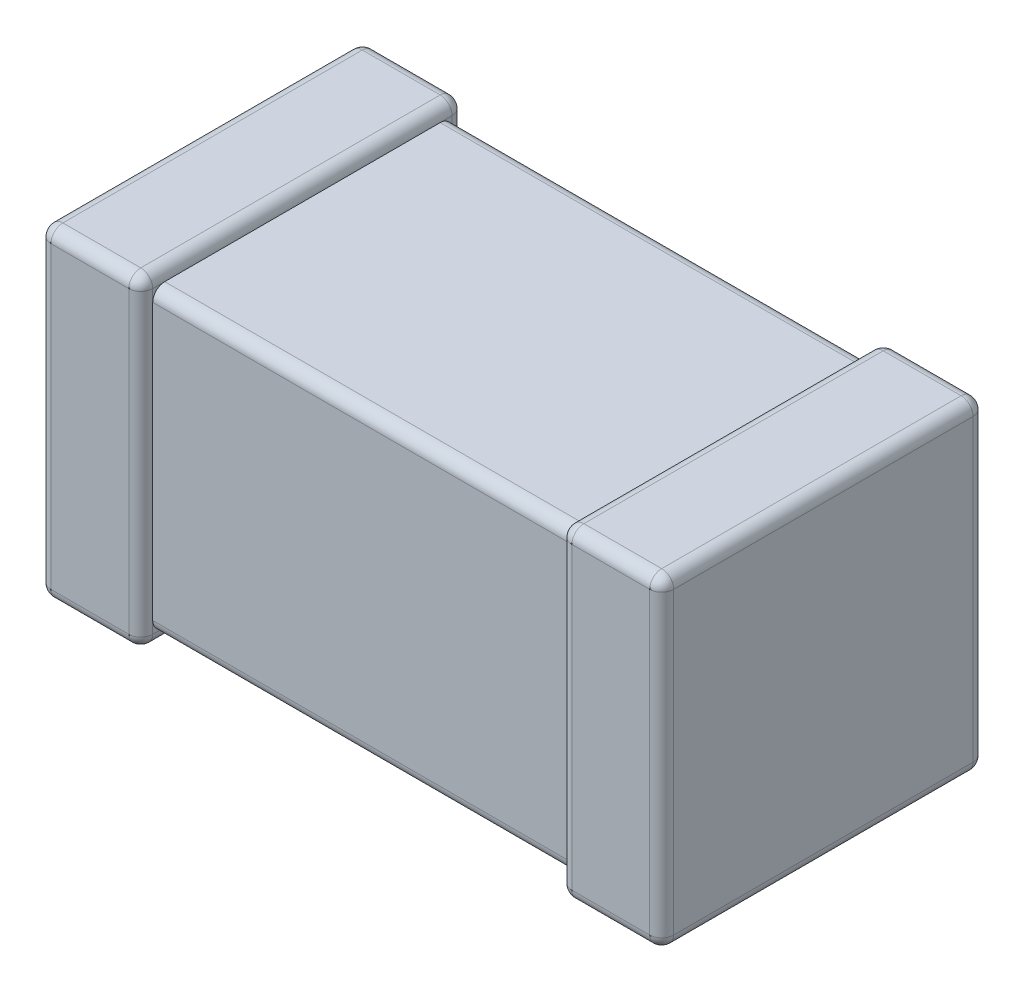
from build123d import *

# Parameters (mm, degrees)
SKETCH2_W                = 1
SKETCH2_H                = 0.5
BOSS_EXTRUDE1_DEPTH      = 0.5
FILLET3_R                = 0.02
BOSS_EXTRUDE3_DEPTH      = 0.02
BOSS_EXTRUDE3_DEPTH_BACK = 0.52
SKETCH3_W                = 0.17
SKETCH3_H                = 0.54
FILLET4_R                = 0.02
BOSS_EXTRUDE4_DEPTH      = 0.01
BOSS_EXTRUDE4_2_DEPTH    = 0.01
BOSS_EXTRUDE4_3_DEPTH    = 0.01


with BuildPart() as part:
    # Sketch2 → Boss-Extrude1 (new body)
    with BuildSketch(Plane(origin=(0, 0, 0), x_dir=(1, 0, 0), z_dir=(0, 1, 0))):
        with Locations((0.5, 0.25)):
            Rectangle(SKETCH2_W, SKETCH2_H)
    extrude(amount=BOSS_EXTRUDE1_DEPTH)

    # Fillet3
    fillet3_edges = [part.edges().sort_by_distance(p)[0] for p in [
        (0, 0, -0.25),
        (0.5, 0, -0.5),
        (1, 0, -0.25),
        (0.5, 0, 0),
        (0, 0.5, -0.25),
        (0.5, 0.5, -0.5),
        (1, 0.5, -0.25),
        (0.5, 0.5, 0),
        (0, 0.25, -0.5),
        (1, 0.25, -0.5),
        (1, 0.25, 0),
        (0, 0.25, 0),
    ]]
    fillet(fillet3_edges, radius=FILLET3_R)


with BuildPart() as body_2:
    # Sketch3 → Boss-Extrude3 (new, two sides: drawn at the far end of the back side and taken through both)
    with BuildSketch(Plane.XY.offset(-BOSS_EXTRUDE3_DEPTH_BACK)):
        with Locations((0.065, 0.25)):
            Rectangle(SKETCH3_W, SKETCH3_H)
    extrude(amount=BOSS_EXTRUDE3_DEPTH + BOSS_EXTRUDE3_DEPTH_BACK)

    # Fillet4
    fillet4_edges = [body_2.edges().sort_by_distance(p)[0] for p in [
        (-0.02, 0.52, -0.25),
        (0.15, 0.52, -0.25),
        (-0.02, -0.02, -0.25),
        (0.15, -0.02, -0.25),
        (0.065, -0.02, -0.52),
        (0.15, 0.25, -0.52),
        (0.065, 0.52, -0.52),
        (-0.02, 0.25, -0.52),
        (0.065, 0.52, 0.02),
        (0.15, 0.25, 0.02),
        (0.065, -0.02, 0.02),
        (-0.02, 0.25, 0.02),
    ]]
    fillet(fillet4_edges, radius=FILLET4_R)


with BuildPart() as body_3:
    # Body-Move/Copy1: copy of body 2
    add(body_2.part.moved(Location((0.87, 0, 0))))


with BuildPart() as body_4:
    # Sketch4 → Boss-Extrude4 (new body)
    with BuildSketch(Plane.XY):
        with BuildLine():
            Line((0.399439087, 0.336565272), (0.424243775, 0.311425763))
            Line((0.424243775, 0.311425763), (0.424662301, 0.309556343))
            Line((0.424662301, 0.309556343), (0.424662301, 0.284640048))
            Line((0.424662301, 0.284640048), (0.424243775, 0.283189155))
            Line((0.424243775, 0.283189155), (0.39885315, 0.258049647))
            Line((0.39885315, 0.258049647), (0.397011632, 0.257435807))
            Line((0.397011632, 0.257435807), (0.351336409, 0.257435807))
            Line((0.351336409, 0.257435807), (0.330019444, 0.236927995))
            Line((0.330019444, 0.236927995), (0.330019444, 0.196721522))
            Line((0.330019444, 0.196721522), (0.421397792, 0.196721522))
            add(Edge.make_bspline(
                [(0.421397792, 0.196721522), (0.421888097, 0.196611548), (0.422821182, 0.196402261), (0.423981763, 0.195437698), (0.424583336, 0.193958707), (0.424634441, 0.192857555), (0.424662301, 0.192257236)],
                knots=[0, 0, 0, 0, 0.972653314, 1.851030225, 2.828438158, 4, 4, 4, 4], degree=3))
            add(Edge.make_bspline(
                [(0.424662301, 0.192257236), (0.424632899, 0.191665735), (0.424577121, 0.190543651), (0.424034695, 0.189237989), (0.423301483, 0.188424544), (0.422456151, 0.188038901), (0.421379922, 0.187838563), (0.420580409, 0.187809099), (0.420142212, 0.18779295)],
                knots=[0, 0, 0, 0, 1.434830483, 2.721889557, 3.346325591, 4.054937858, 4.933952885, 6, 6, 6, 6], degree=3))
            Line((0.420142212, 0.18779295), (0.323769444, 0.18779295))
            add(Edge.make_bspline(
                [(0.323769444, 0.18779295), (0.323445712, 0.187938021), (0.322830678, 0.188213629), (0.322049992, 0.188823322), (0.321440854, 0.189552425), (0.321207164, 0.190128865), (0.321090873, 0.190415718)],
                knots=[0, 0, 0, 0, 1.095907464, 2.08203456, 3.045567458, 4, 4, 4, 4], degree=3))
            Line((0.321090873, 0.190415718), (0.321090873, 0.194461477))
            Line((0.321090873, 0.194461477), (0.321090873, 0.241308575))
            Line((0.321090873, 0.241308575), (0.346537301, 0.265973754))
            Line((0.346537301, 0.265973754), (0.347792882, 0.266364379))
            Line((0.347792882, 0.266364379), (0.394388864, 0.266364379))
            Line((0.394388864, 0.266364379), (0.41573373, 0.287597638))
            Line((0.41573373, 0.287597638), (0.41573373, 0.30763112))
            Line((0.41573373, 0.30763112), (0.394667882, 0.328864379))
            Line((0.394667882, 0.328864379), (0.350722569, 0.328864379))
            Line((0.350722569, 0.328864379), (0.327424578, 0.305426879))
            add(Edge.make_bspline(
                [(0.327424578, 0.305426879), (0.32705561, 0.305309061), (0.32639099, 0.305096838), (0.325696629, 0.305035595), (0.325387748, 0.305008352)],
                knots=[0, 0, 0, 0, 1.110314269, 2, 2, 2, 2], degree=3))
            add(Edge.make_bspline(
                [(0.325387748, 0.305008352), (0.324817831, 0.305056183), (0.32369671, 0.305150274), (0.322468399, 0.305923024), (0.321754387, 0.306787209), (0.321349387, 0.307594449), (0.321143104, 0.308551116), (0.321108783, 0.309229987), (0.321090873, 0.309584245)],
                knots=[0, 0, 0, 0, 1.43776488, 2.828318719, 3.533469534, 4.273415568, 5.099010321, 6, 6, 6, 6], degree=3))
            Line((0.321090873, 0.309584245), (0.3215094, 0.311453664))
            Line((0.3215094, 0.311453664), (0.346732614, 0.336955897))
            Line((0.346732614, 0.336955897), (0.348378819, 0.33779295))
            Line((0.348378819, 0.33779295), (0.397988194, 0.337597638))
            Line((0.397988194, 0.337597638), (0.399439087, 0.336565272))
        make_face()
    extrude(amount=BOSS_EXTRUDE4_DEPTH)


with BuildPart() as body_5:
    # Sketch4 → Boss-Extrude4 2 (new body)
    with BuildSketch(Plane.XY):
        with BuildLine():
            Line((0.526403373, 0.336565272), (0.55120806, 0.311732682))
            Line((0.55120806, 0.311732682), (0.551626587, 0.309919066))
            Line((0.551626587, 0.309919066), (0.551626587, 0.285281789))
            Line((0.551626587, 0.285281789), (0.550984846, 0.283858798))
            Line((0.550984846, 0.283858798), (0.529109846, 0.262681343))
            Line((0.529109846, 0.262681343), (0.550984846, 0.241113263))
            Line((0.550984846, 0.241113263), (0.551626587, 0.239690272))
            Line((0.551626587, 0.239690272), (0.551626587, 0.214467057))
            Line((0.551626587, 0.214467057), (0.551012748, 0.212820852))
            Line((0.551012748, 0.212820852), (0.52573373, 0.187988263))
            Line((0.52573373, 0.187988263), (0.523668998, 0.18779295))
            Line((0.523668998, 0.18779295), (0.474561855, 0.18779295))
            Line((0.474561855, 0.18779295), (0.473334176, 0.188602102))
            Line((0.473334176, 0.188602102), (0.448250471, 0.21309987))
            add(Edge.make_bspline(
                [(0.448250471, 0.21309987), (0.448197162, 0.213359524), (0.448063174, 0.214012147), (0.448058171, 0.214679224), (0.448055159, 0.215080897)],
                knots=[0, 0, 0, 0, 0.795724138, 2, 2, 2, 2], degree=3))
            add(Edge.make_bspline(
                [(0.448055159, 0.215080897), (0.448056936, 0.215371945), (0.448059839, 0.215847069), (0.448197239, 0.216300367), (0.448250471, 0.216475986)],
                knots=[0, 0, 0, 0, 1.225148227, 2, 2, 2, 2], degree=3))
            add(Edge.make_bspline(
                [(0.448250471, 0.216475986), (0.448442469, 0.21685484), (0.448814478, 0.217588893), (0.449745762, 0.218420181), (0.45085685, 0.219041151), (0.451711199, 0.219189043), (0.452156721, 0.219266164)],
                knots=[0, 0, 0, 0, 1.004527468, 1.946335261, 2.929065655, 4, 4, 4, 4], degree=3))
            add(Edge.make_bspline(
                [(0.452156721, 0.219266164), (0.452485124, 0.219255055), (0.45313872, 0.219232945), (0.454055865, 0.218904713), (0.454915337, 0.218419753), (0.455375872, 0.217949444), (0.455616542, 0.217703664)],
                knots=[0, 0, 0, 0, 1.001337907, 1.992890517, 2.951104048, 4, 4, 4, 4], degree=3))
            Line((0.455616542, 0.217703664), (0.477686855, 0.196721522))
            Line((0.477686855, 0.196721522), (0.521632167, 0.196721522))
            Line((0.521632167, 0.196721522), (0.542698016, 0.217424647))
            Line((0.542698016, 0.217424647), (0.542698016, 0.236732682))
            Line((0.542698016, 0.236732682), (0.52135315, 0.257435807))
            Line((0.52135315, 0.257435807), (0.49838998, 0.257435807))
            add(Edge.make_bspline(
                [(0.49838998, 0.257435807), (0.497884806, 0.257633597), (0.496933871, 0.258005915), (0.495858152, 0.259110726), (0.495172431, 0.260509076), (0.495123421, 0.261565878), (0.495097569, 0.262123307)],
                knots=[0, 0, 0, 0, 1.043123538, 1.963565367, 2.925846864, 4, 4, 4, 4], degree=3))
            add(Edge.make_bspline(
                [(0.495097569, 0.262123307), (0.495164119, 0.262750362), (0.495299445, 0.264025455), (0.496109081, 0.265021239), (0.49652056, 0.265527325)],
                knots=[0, 0, 0, 0, 0.98354347, 2, 2, 2, 2], degree=3))
            add(Edge.make_bspline(
                [(0.49652056, 0.265527325), (0.496721079, 0.265655922), (0.497154904, 0.265934144), (0.497951618, 0.266210209), (0.498925746, 0.266329093), (0.499626731, 0.266351942), (0.500008284, 0.266364379)],
                knots=[0, 0, 0, 0, 0.78205906, 1.691991385, 2.743730218, 4, 4, 4, 4], degree=3))
            Line((0.500008284, 0.266364379), (0.52135315, 0.266364379))
            Line((0.52135315, 0.266364379), (0.542698016, 0.287597638))
            Line((0.542698016, 0.287597638), (0.542698016, 0.30763112))
            Line((0.542698016, 0.30763112), (0.521632167, 0.328864379))
            Line((0.521632167, 0.328864379), (0.477686855, 0.328864379))
            Line((0.477686855, 0.328864379), (0.454388864, 0.305426879))
            add(Edge.make_bspline(
                [(0.454388864, 0.305426879), (0.454019895, 0.305309061), (0.453355276, 0.305096838), (0.452660915, 0.305035595), (0.452352034, 0.305008352)],
                knots=[0, 0, 0, 0, 1.110314269, 2, 2, 2, 2], degree=3))
            add(Edge.make_bspline(
                [(0.452352034, 0.305008352), (0.451782116, 0.305056183), (0.450660996, 0.305150274), (0.449432685, 0.305923024), (0.448718672, 0.306787209), (0.448313673, 0.307594449), (0.44810739, 0.308551116), (0.448073069, 0.309229987), (0.448055159, 0.309584245)],
                knots=[0, 0, 0, 0, 1.43776488, 2.828318719, 3.533469534, 4.273415568, 5.099010321, 6, 6, 6, 6], degree=3))
            Line((0.448055159, 0.309584245), (0.448473685, 0.311453664))
            Line((0.448473685, 0.311453664), (0.4736969, 0.336955897))
            Line((0.4736969, 0.336955897), (0.475343105, 0.33779295))
            Line((0.475343105, 0.33779295), (0.52495248, 0.337597638))
            Line((0.52495248, 0.337597638), (0.526403373, 0.336565272))
        make_face()
    extrude(amount=BOSS_EXTRUDE4_2_DEPTH)


with BuildPart() as body_6:
    # Sketch4 → Boss-Extrude4 3 (new body)
    with BuildSketch(Plane.XY):
        with BuildLine():
            Line((0.653367659, 0.336565272), (0.678172346, 0.311732682))
            Line((0.678172346, 0.311732682), (0.678590873, 0.309919066))
            Line((0.678590873, 0.309919066), (0.678590873, 0.285281789))
            Line((0.678590873, 0.285281789), (0.677949132, 0.283858798))
            Line((0.677949132, 0.283858798), (0.656074132, 0.262681343))
            Line((0.656074132, 0.262681343), (0.677949132, 0.241113263))
            Line((0.677949132, 0.241113263), (0.678590873, 0.239690272))
            Line((0.678590873, 0.239690272), (0.678590873, 0.214467057))
            Line((0.678590873, 0.214467057), (0.677977034, 0.212820852))
            Line((0.677977034, 0.212820852), (0.652698016, 0.187988263))
            Line((0.652698016, 0.187988263), (0.650633284, 0.18779295))
            Line((0.650633284, 0.18779295), (0.601526141, 0.18779295))
            Line((0.601526141, 0.18779295), (0.600298462, 0.188602102))
            Line((0.600298462, 0.188602102), (0.575214757, 0.21309987))
            add(Edge.make_bspline(
                [(0.575214757, 0.21309987), (0.575161448, 0.213359524), (0.57502746, 0.214012147), (0.575022457, 0.214679224), (0.575019444, 0.215080897)],
                knots=[0, 0, 0, 0, 0.795724138, 2, 2, 2, 2], degree=3))
            add(Edge.make_bspline(
                [(0.575019444, 0.215080897), (0.575021222, 0.215371945), (0.575024125, 0.215847069), (0.575161524, 0.216300367), (0.575214757, 0.216475986)],
                knots=[0, 0, 0, 0, 1.225148227, 2, 2, 2, 2], degree=3))
            add(Edge.make_bspline(
                [(0.575214757, 0.216475986), (0.575406755, 0.21685484), (0.575778764, 0.217588893), (0.576710048, 0.218420181), (0.577821136, 0.219041151), (0.578675485, 0.219189043), (0.579121007, 0.219266164)],
                knots=[0, 0, 0, 0, 1.004527468, 1.946335261, 2.929065655, 4, 4, 4, 4], degree=3))
            add(Edge.make_bspline(
                [(0.579121007, 0.219266164), (0.579449409, 0.219255055), (0.580103006, 0.219232945), (0.581020151, 0.218904713), (0.581879623, 0.218419753), (0.582340157, 0.217949444), (0.582580828, 0.217703664)],
                knots=[0, 0, 0, 0, 1.001337907, 1.992890517, 2.951104048, 4, 4, 4, 4], degree=3))
            Line((0.582580828, 0.217703664), (0.604651141, 0.196721522))
            Line((0.604651141, 0.196721522), (0.648596453, 0.196721522))
            Line((0.648596453, 0.196721522), (0.669662301, 0.217424647))
            Line((0.669662301, 0.217424647), (0.669662301, 0.236732682))
            Line((0.669662301, 0.236732682), (0.648317435, 0.257435807))
            Line((0.648317435, 0.257435807), (0.625354266, 0.257435807))
            add(Edge.make_bspline(
                [(0.625354266, 0.257435807), (0.624849091, 0.257633597), (0.623898156, 0.258005915), (0.622822438, 0.259110726), (0.622136717, 0.260509076), (0.622087706, 0.261565878), (0.622061855, 0.262123307)],
                knots=[0, 0, 0, 0, 1.043123538, 1.963565367, 2.925846864, 4, 4, 4, 4], degree=3))
            add(Edge.make_bspline(
                [(0.622061855, 0.262123307), (0.622128404, 0.262750362), (0.62226373, 0.264025455), (0.623073366, 0.265021239), (0.623484846, 0.265527325)],
                knots=[0, 0, 0, 0, 0.98354347, 2, 2, 2, 2], degree=3))
            add(Edge.make_bspline(
                [(0.623484846, 0.265527325), (0.623685365, 0.265655922), (0.62411919, 0.265934144), (0.624915903, 0.266210209), (0.625890032, 0.266329093), (0.626591017, 0.266351942), (0.626972569, 0.266364379)],
                knots=[0, 0, 0, 0, 0.78205906, 1.691991385, 2.743730218, 4, 4, 4, 4], degree=3))
            Line((0.626972569, 0.266364379), (0.648317435, 0.266364379))
            Line((0.648317435, 0.266364379), (0.669662301, 0.287597638))
            Line((0.669662301, 0.287597638), (0.669662301, 0.30763112))
            Line((0.669662301, 0.30763112), (0.648596453, 0.328864379))
            Line((0.648596453, 0.328864379), (0.604651141, 0.328864379))
            Line((0.604651141, 0.328864379), (0.58135315, 0.305426879))
            add(Edge.make_bspline(
                [(0.58135315, 0.305426879), (0.580984181, 0.305309061), (0.580319561, 0.305096838), (0.579625201, 0.305035595), (0.579316319, 0.305008352)],
                knots=[0, 0, 0, 0, 1.110314269, 2, 2, 2, 2], degree=3))
            add(Edge.make_bspline(
                [(0.579316319, 0.305008352), (0.578746402, 0.305056183), (0.577625281, 0.305150274), (0.576396971, 0.305923024), (0.575682958, 0.306787209), (0.575277959, 0.307594449), (0.575071676, 0.308551116), (0.575037354, 0.309229987), (0.575019444, 0.309584245)],
                knots=[0, 0, 0, 0, 1.43776488, 2.828318719, 3.533469534, 4.273415568, 5.099010321, 6, 6, 6, 6], degree=3))
            Line((0.575019444, 0.309584245), (0.575437971, 0.311453664))
            Line((0.575437971, 0.311453664), (0.600661185, 0.336955897))
            Line((0.600661185, 0.336955897), (0.602307391, 0.33779295))
            Line((0.602307391, 0.33779295), (0.651916766, 0.337597638))
            Line((0.651916766, 0.337597638), (0.653367659, 0.336565272))
        make_face()
    extrude(amount=BOSS_EXTRUDE4_3_DEPTH)


solid = Compound([part.part, body_2.part, body_3.part])
